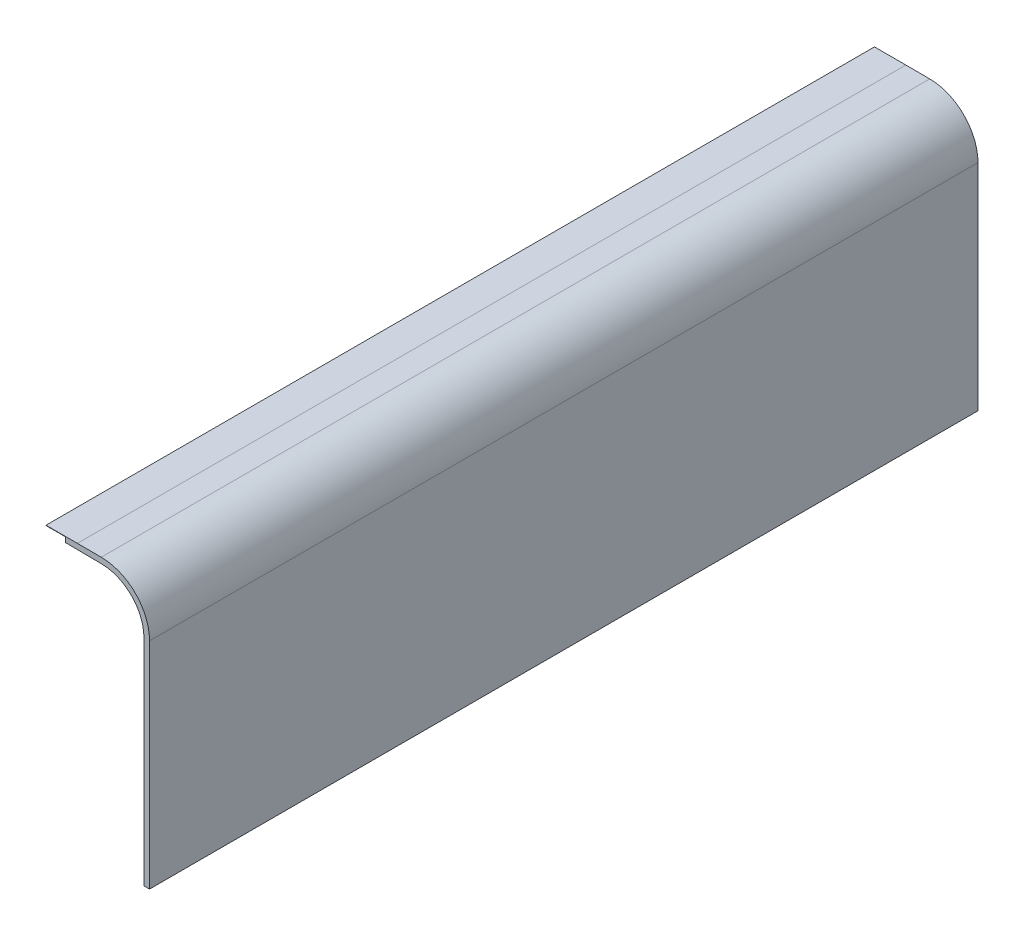
from build123d import *

# Parameters (mm, degrees)
BOSS_EXTRUDE1_DEPTH = 1478.120000035


with BuildPart() as part:
    # Sketch1 → Boss-Extrude1 (new body)
    with BuildSketch(Plane.XY):
        with BuildLine():
            Line((459.721789204, -469.9), (459.721789204, -86.36))
            ThreePointArc((459.721789204, -86.36), (437.403325931, -32.478463274), (383.521789204, -10.16))
            Line((383.521789204, -10.16), (320.021789204, -9.5))
            Line((320.021789204, -9.5), (320.021789204, -0.6))
            Line((320.021789204, -0.6), (284.979491485, -0.6))
            Line((284.979491485, -0.6), (284.979491485, 0))
            Line((284.979491485, 0), (340.976408313, 0))
            Line((340.976408313, 0), (383.5411635, -0.160002177))
            ThreePointArc((383.5411635, -0.160002177), (444.481243206, -25.414245695), (469.721789204, -86.36))
            Line((469.721789204, -86.36), (469.721789204, -469.9))
            Line((469.721789204, -469.9), (459.721789204, -469.9))
        make_face()
    extrude(amount=-BOSS_EXTRUDE1_DEPTH)


solid = part.part
